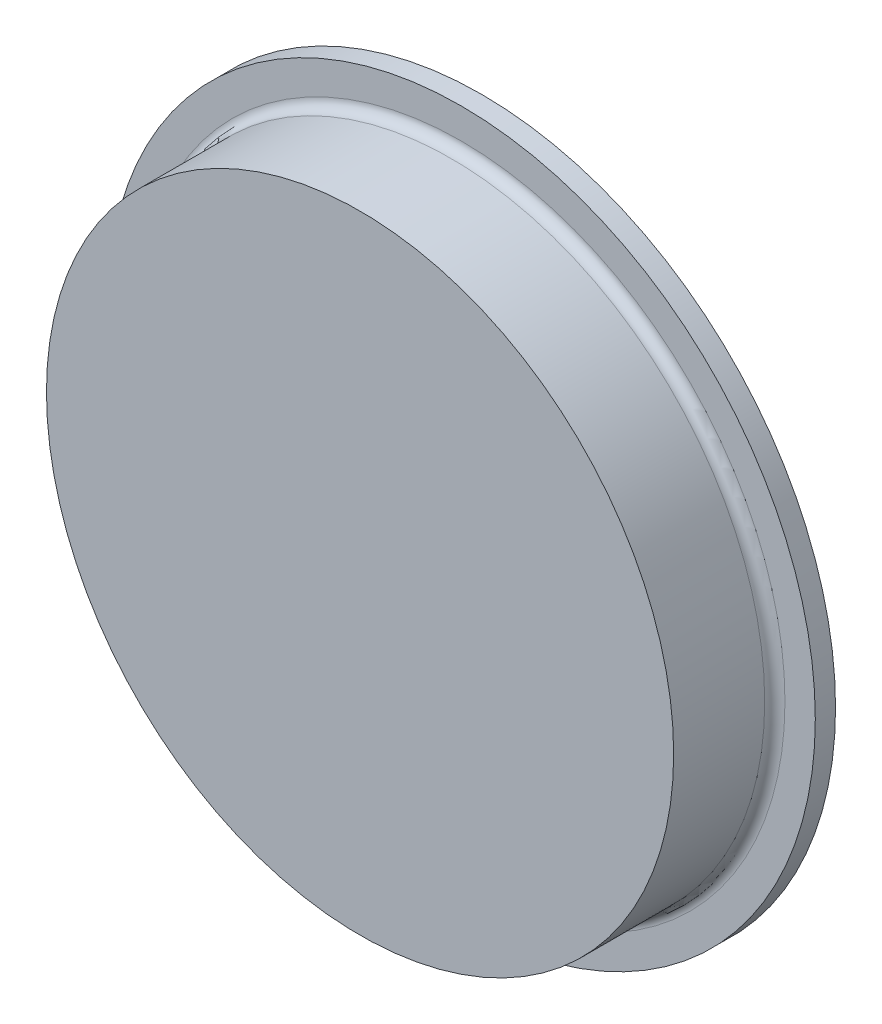
from build123d import *

# Parameters (mm, degrees)
SKETCH1_R           = 31
BOSS_EXTRUDE1_DEPTH = 5
SKETCH2_R           = 35
BOSS_EXTRUDE2_DEPTH = 2
SKETCH3_R           = 5
BOSS_EXTRUDE3_DEPTH = 11
FILLET1_R           = 1


with BuildPart() as part:
    # Sketch1 → Boss-Extrude1 (new, symmetric)
    with BuildSketch(Plane.XY):
        Circle(SKETCH1_R)
    extrude(amount=BOSS_EXTRUDE1_DEPTH, both=True)

    # Sketch2 → Boss-Extrude2 (add)
    with BuildSketch(Plane(origin=(0, 0, -5), x_dir=(-1, 0, 0), z_dir=(0, 0, -1))):
        Circle(SKETCH2_R)
    extrude(amount=BOSS_EXTRUDE2_DEPTH)

    # Sketch3 → Boss-Extrude3 (add)
    with BuildSketch(Plane(origin=(0, 0, -7), x_dir=(-1, 0, 0), z_dir=(0, 0, -1))):
        Circle(SKETCH3_R)
    extrude(amount=BOSS_EXTRUDE3_DEPTH)

    # Fillet1
    fillet1_edges = [part.edges().sort_by_distance(p)[0] for p in [
        (5, 0, -7),
        (-31, 0, -5),
    ]]
    fillet(fillet1_edges, radius=FILLET1_R)


solid = part.part
